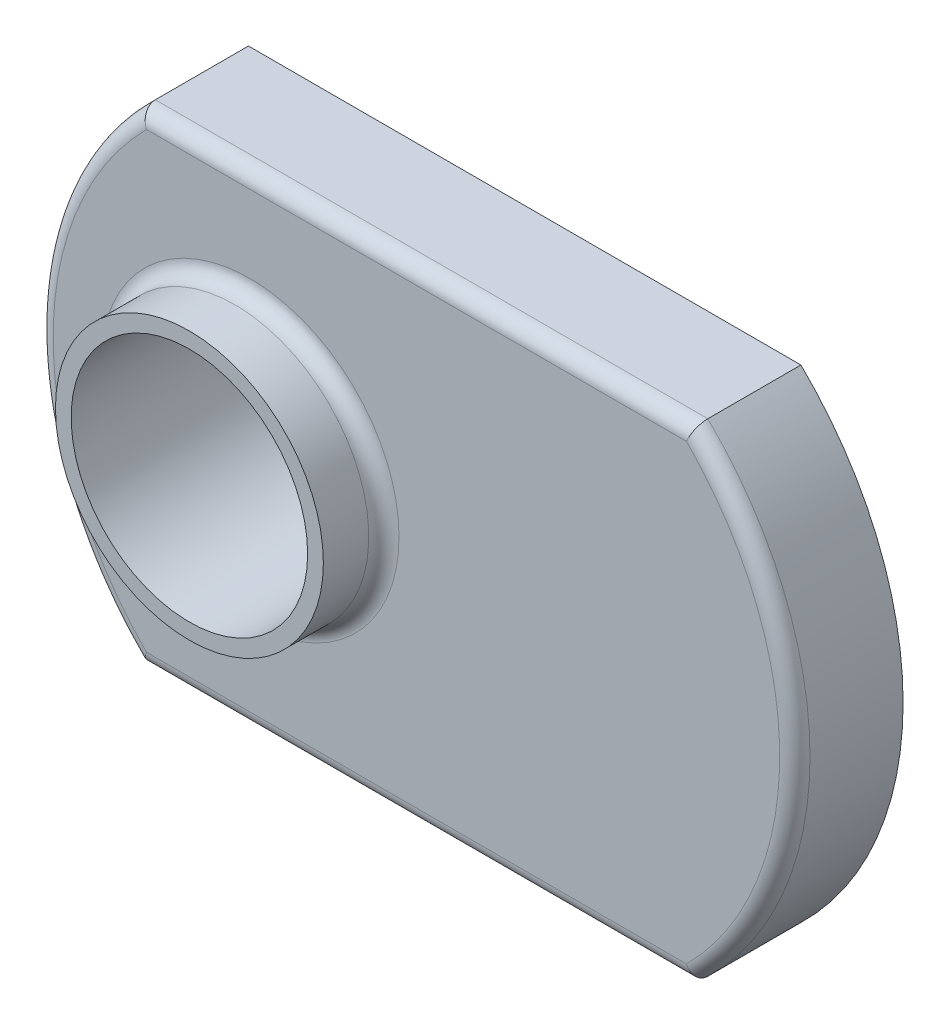
from build123d import *

# Parameters (mm, degrees)
SKETCH1_W                          = 25.4
SKETCH1_H                          = 16.2052
BASE_EXTRUDE_DEPTH                 = 3.6322
SKETCH2_R                          = 4.4958
BOSS_EXTRUDE1_DEPTH                = 2.032
F_5_16_18_TAPPED_HOLE1_D           = 6.5278
F_5_16_18_TAPPED_HOLE1_CBORE_D     = 7.9375
F_5_16_18_TAPPED_HOLE1_CBORE_DEPTH = 15.875
CUT_EXTRUDE1_DEPTH                 = 31.347345582
CUT_EXTRUDE1_DEPTH_BACK            = 31.347345582
CUT_EXTRUDE2_DEPTH                 = 31.347345582
CUT_EXTRUDE2_DEPTH_BACK            = 31.347345582
FILLET1_R                          = 0.508


with BuildPart() as part:
    # Sketch1 → Base-Extrude (new body)
    with BuildSketch(Plane.XY):
        with Locations((12.7, 8.1026)):
            Rectangle(SKETCH1_W, SKETCH1_H)
    extrude(amount=-BASE_EXTRUDE_DEPTH)

    # Sketch2 → Boss-Extrude1 (add)
    with BuildSketch(Plane.XY):
        with Locations(Location((7.112, 8.1026, 0), (0, 0, 180))):
            Circle(SKETCH2_R)
    extrude(amount=BOSS_EXTRUDE1_DEPTH)

    # 5/16-18 Tapped Hole1 (through all)
    with Locations(Plane(origin=(7.112, 8.1026, 2.032), x_dir=(1, 0, 0), z_dir=(0, 0, 1))):
        with Locations((0, 0)):
            CounterBoreHole(F_5_16_18_TAPPED_HOLE1_D / 2, F_5_16_18_TAPPED_HOLE1_CBORE_D / 2, F_5_16_18_TAPPED_HOLE1_CBORE_DEPTH)

    # Sketch4 → Cut-Extrude1 (cut, two sides: drawn at the far end of the back side and taken through both)
    with BuildSketch(Plane.XY.offset(-CUT_EXTRUDE1_DEPTH_BACK)):
        with BuildLine():
            Line((-24.402199862, 61.181765932), (21.971, 16.2052))
            ThreePointArc((21.971, 16.2052), (25.4, 8.1026), (21.971, 0))
            Line((21.971, 0), (-24.402199862, -44.976565932))
            Line((-24.402199862, -44.976565932), (104.800975772, -44.976565932))
            Line((104.800975772, -44.976565932), (104.800975772, 61.181765932))
            Line((104.800975772, 61.181765932), (-24.402199862, 61.181765932))
        make_face()
    extrude(amount=CUT_EXTRUDE1_DEPTH + CUT_EXTRUDE1_DEPTH_BACK, mode=Mode.SUBTRACT)

    # Sketch6 → Cut-Extrude2 (cut, two sides: drawn at the far end of the back side and taken through both)
    with BuildSketch(Plane.XY.offset(-CUT_EXTRUDE2_DEPTH_BACK)):
        with BuildLine():
            Line((49.802199862, 61.181765932), (3.429, 16.2052))
            ThreePointArc((3.429, 16.2052), (0, 8.1026), (3.429, 0))
            Line((3.429, 0), (49.802199862, -44.976565932))
            Line((49.802199862, -44.976565932), (-79.400975772, -44.976565932))
            Line((-79.400975772, -44.976565932), (-79.400975772, 61.181765932))
            Line((-79.400975772, 61.181765932), (49.802199862, 61.181765932))
        make_face()
    extrude(amount=CUT_EXTRUDE2_DEPTH + CUT_EXTRUDE2_DEPTH_BACK, mode=Mode.SUBTRACT)

    # Fillet1
    fillet1_edges = [part.edges().sort_by_distance(p)[0] for p in [
        (12.7, 0, 0),
        (0, 8.1026, 0),
        (12.7, 16.2052, 0),
        (11.6078, 8.1026, 0),
        (25.4, 8.1026, 0),
    ]]
    fillet(fillet1_edges, radius=FILLET1_R)


solid = part.part
